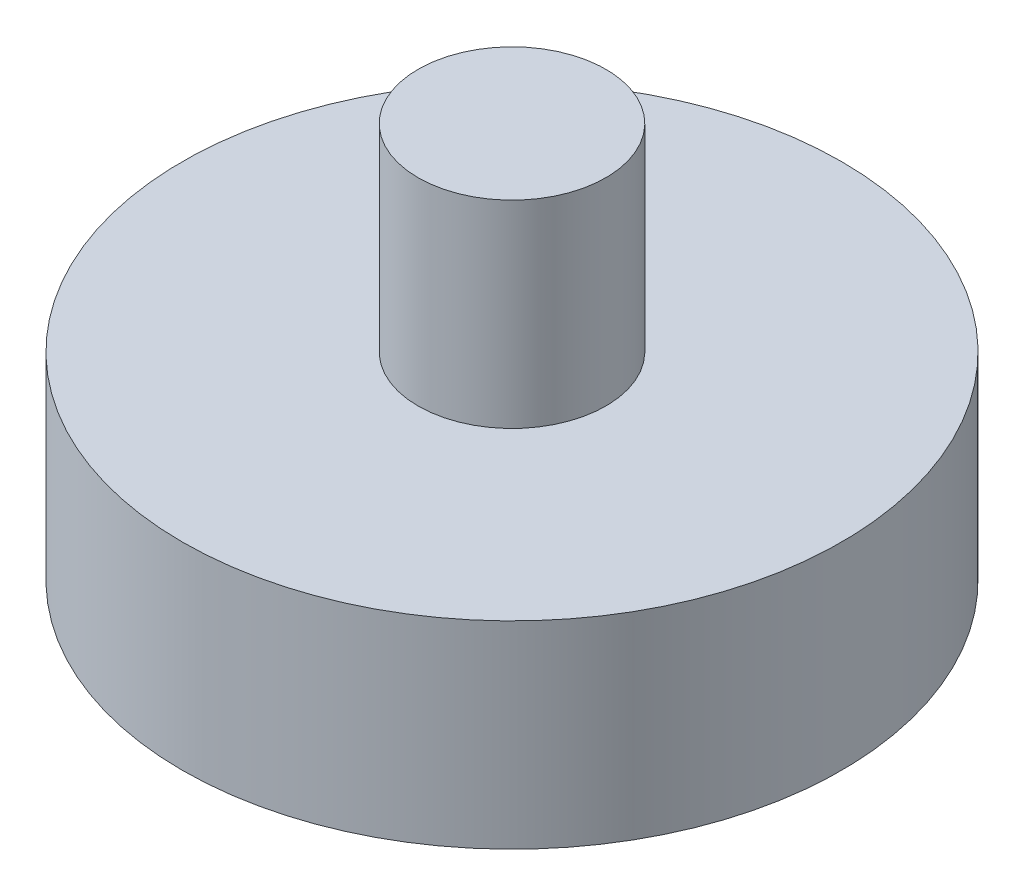
from build123d import *

# Parameters (mm, degrees)
CROQUIS2_R              = 5
SALIENTE_EXTRUIR1_DEPTH = 3
CROQUIS3_R              = 1.425
SALIENTE_EXTRUIR2_DEPTH = 3


with BuildPart() as part:
    # Croquis2 → Saliente-Extruir1 (new body)
    with BuildSketch(Plane(origin=(0, 0, 0), x_dir=(1, 0, 0), z_dir=(0, 1, 0))):
        with Locations(Location((0, 0, 0), (0, 0, 270))):
            Circle(CROQUIS2_R)
    extrude(amount=SALIENTE_EXTRUIR1_DEPTH)

    # Croquis3 → Saliente-Extruir2 (add)
    with BuildSketch(Plane(origin=(0, 3, 0), x_dir=(1, 0, 0), z_dir=(0, 1, 0))):
        with Locations(Location((0, 0, 0), (0, 0, 270))):
            Circle(CROQUIS3_R)
    extrude(amount=SALIENTE_EXTRUIR2_DEPTH)


solid = part.part
